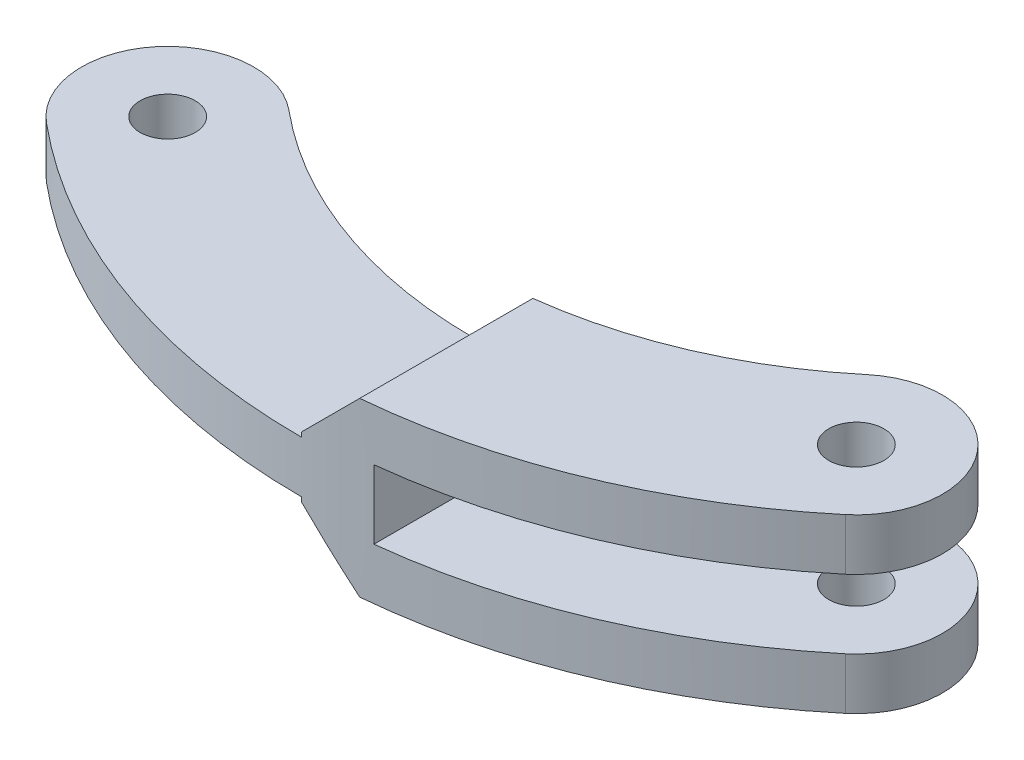
from build123d import *

# Parameters (mm, degrees)
SKETCH1_R               = 0.8
BOSS_EXTRUDE1_DEPTH     = 0.75
SKETCH2_R               = 0.8
BOSS_EXTRUDE2_DEPTH     = 2.5
CHAMFER1_SIZE           = 1.625
CUT_EXTRUDE1_DEPTH      = 24.451236904
CUT_EXTRUDE1_DEPTH_BACK = 24.451236904
SKETCH3_W               = 10.5
SKETCH3_H               = 2


with BuildPart() as part:
    # Sketch1 → Boss-Extrude1 (new, symmetric)
    with BuildSketch(Plane(origin=(0, 0, 0), x_dir=(1, 0, 0), z_dir=(0, 1, 0))):
        with BuildLine():
            ThreePointArc((1.600460999, 1.920553199), (-1.920553199, 1.600460999), (-1.600460999, -1.920553199))
            ThreePointArc((-1.600460999, -1.920553199), (10, -6.120499352), (21.600460999, -1.920553199))
            ThreePointArc((21.600460999, -1.920553199), (21.920553199, 1.600460999), (18.399539001, 1.920553199))
            ThreePointArc((18.399539001, 1.920553199), (10, -1.120499352), (1.600460999, 1.920553199))
        make_face()
        with Locations(Location((0, 0, 0), (0, 0, 270))):
            Circle(SKETCH1_R, mode=Mode.SUBTRACT)
        with Locations(Location((20, 0, 0), (0, 0, 270))):
            Circle(SKETCH1_R, mode=Mode.SUBTRACT)
    extrude(amount=BOSS_EXTRUDE1_DEPTH, both=True)

    # Sketch2 → Boss-Extrude2 (add, symmetric)
    with BuildSketch(Plane(origin=(0, 0, 0), x_dir=(1, 0, 0), z_dir=(0, 1, 0))):
        with BuildLine():
            Line((10, -1.120499352), (10, -6.120499352))
            ThreePointArc((10, -6.120499352), (16.168675771, -5.038190514), (21.600460999, -1.920553199))
            ThreePointArc((21.600460999, -1.920553199), (21.920553199, 1.600460999), (18.399539001, 1.920553199))
            ThreePointArc((18.399539001, 1.920553199), (14.466549452, -0.336832626), (10, -1.120499352))
        make_face()
        with Locations(Location((20, 0, 0), (0, 0, 270))):
            Circle(SKETCH2_R, mode=Mode.SUBTRACT)
    extrude(amount=BOSS_EXTRUDE2_DEPTH, both=True)

    # Chamfer1
    chamfer1_edges = [part.edges().sort_by_distance(p)[0] for p in [
        (10, -2.5, 3.620499352),
        (10, 2.5, 3.620499352),
    ]]
    chamfer(chamfer1_edges, length=CHAMFER1_SIZE)

    # Sketch3 → Cut-Extrude1 (cut, two sides: drawn at the far end of the back side and taken through both)
    with BuildSketch(Plane(origin=(0, 0, 0), x_dir=(-1, 0, 0), z_dir=(0, 0, -1)).offset(-CUT_EXTRUDE1_DEPTH_BACK)):
        with Locations((-17.25, 0)):
            Rectangle(SKETCH3_W, SKETCH3_H)
    extrude(amount=CUT_EXTRUDE1_DEPTH + CUT_EXTRUDE1_DEPTH_BACK, mode=Mode.SUBTRACT)


solid = part.part
